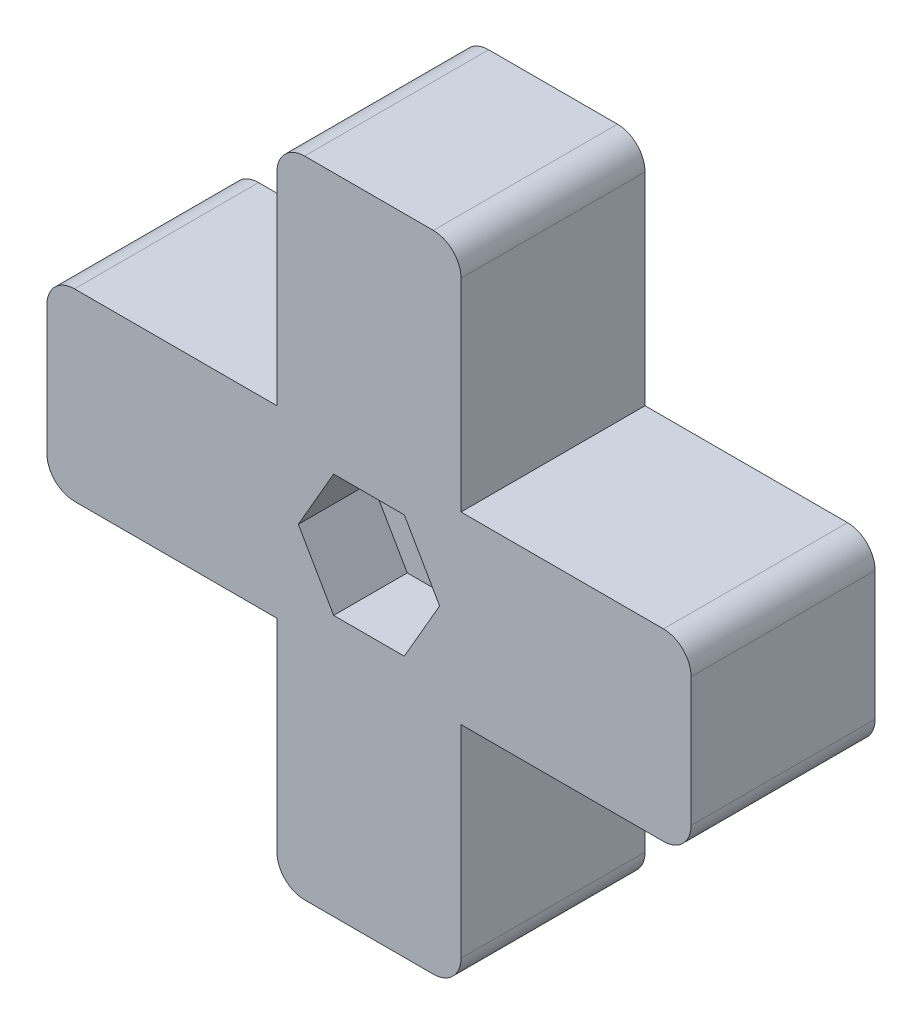
from build123d import *

# Parameters (mm, degrees)
ESQUISSE1_W             = 20
ESQUISSE1_H             = 25
ESQUISSE1_H_2           = 20
ESQUISSE1_W_2           = 25
BOSS_EXTRU_1_DEPTH      = 20
ENL_V_MAT_EXTRU_1_REACH = 87.586
ESQUISSE2_R             = 4.05
ENL_V_MAT_EXTRU_3_DEPTH = 8
CONG_1_R                = 3


with BuildPart() as part:
    # Esquisse1 → Boss.-Extru.1 (new body)
    with BuildSketch(Plane.XY):
        with Locations((35, 32.5)):
            Rectangle(ESQUISSE1_W, ESQUISSE1_H)
        with Locations((35, 10)):
            Rectangle(ESQUISSE1_W, ESQUISSE1_H_2)
        with Locations((12.5, 10)):
            Rectangle(ESQUISSE1_W_2, ESQUISSE1_H_2)
        with Locations((35, -12.5)):
            Rectangle(ESQUISSE1_W, ESQUISSE1_H)
        with Locations((57.5, 10)):
            Rectangle(ESQUISSE1_W_2, ESQUISSE1_H_2)
    extrude(amount=BOSS_EXTRU_1_DEPTH)

    # Esquisse2 → Enlèv. mat.-Extru.1 (cut, up to next)
    with BuildSketch(Plane.XY.offset(20), mode=Mode.PRIVATE) as enl_v_mat_extru_1_sk1:
        with Locations((35, 10)):
            Circle(ESQUISSE2_R)
    enl_v_mat_extru_1_tool1 = extrude(enl_v_mat_extru_1_sk1.sketch, amount=-ENL_V_MAT_EXTRU_1_REACH, mode=Mode.PRIVATE) & part.part
    add(enl_v_mat_extru_1_tool1.solids().sort_by_distance((35, 10, 20))[0], mode=Mode.SUBTRACT)

    # Esquisse4 → Enlèv. mat.-Extru.3 (cut)
    with BuildSketch(Plane.XY.offset(20)):
        Polygon((27.32124142, 10), (31.16062071, 3.35), (38.83937929, 3.35), (42.67875858, 10), (38.83937929, 16.65), (31.16062071, 16.65), align=None)
    extrude(amount=-ENL_V_MAT_EXTRU_3_DEPTH, mode=Mode.SUBTRACT)

    # Congé1
    cong_1_edges = [part.edges().sort_by_distance(p)[0] for p in [
        (45, 45, 10),
        (70, 20, 10),
        (70, 0, 10),
        (45, -25, 10),
        (25, -25, 10),
        (0, 0, 10),
        (0, 20, 10),
        (25, 45, 10),
    ]]
    fillet(cong_1_edges, radius=CONG_1_R)


solid = part.part
